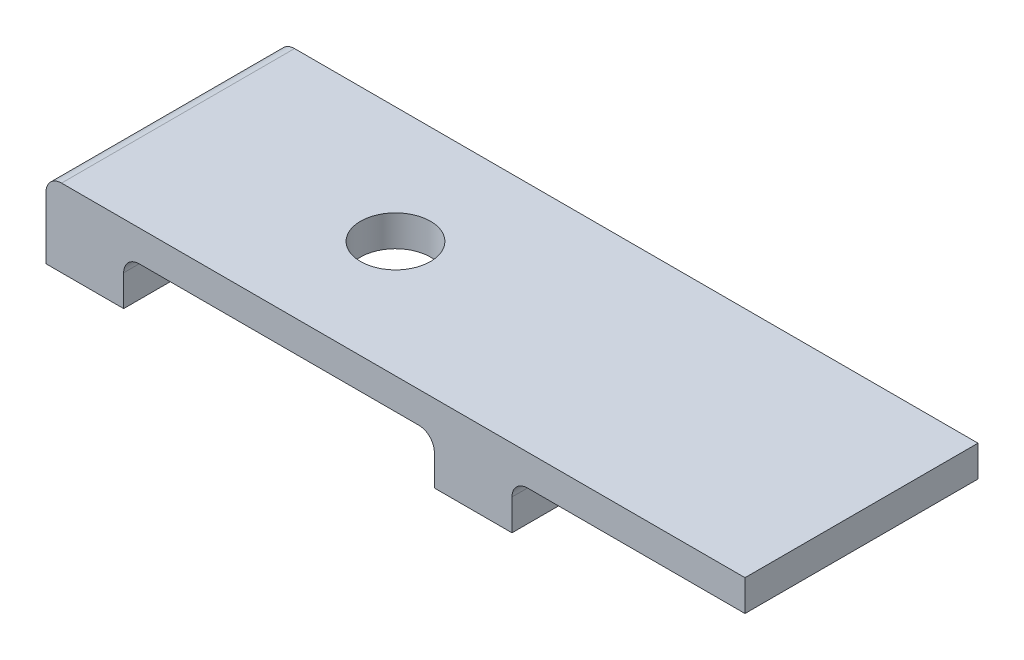
from build123d import *

# Parameters (mm, degrees)
BOSS_EXTRUDE1_DEPTH = 15
FILLET1_R           = 1
FILLET2_R           = 1
FILLET3_R           = 1
FILLET4_R           = 1
SKETCH2_R           = 2.25
CUT_EXTRUDE1_DEPTH  = 5


with BuildPart() as part:
    # Sketch1 → Boss-Extrude1 (new body)
    with BuildSketch(Plane.XY):
        Polygon((0, 0), (45, 0), (45, -2), (30, -2), (30, -5), (25, -5), (25, -2), (5, -2), (5, -5), (0, -5), align=None)
    extrude(amount=BOSS_EXTRUDE1_DEPTH)

    # Fillet1
    fillet1_edges = [part.edges().sort_by_distance(p)[0] for p in [
        (0, 0, 7.5),
    ]]
    fillet(fillet1_edges, radius=FILLET1_R)

    # Fillet2
    fillet2_edges = [part.edges().sort_by_distance(p)[0] for p in [
        (5, -2, 7.5),
    ]]
    fillet(fillet2_edges, radius=FILLET2_R)

    # Fillet3
    fillet3_edges = [part.edges().sort_by_distance(p)[0] for p in [
        (25, -2, 7.5),
    ]]
    fillet(fillet3_edges, radius=FILLET3_R)

    # Fillet4
    fillet4_edges = [part.edges().sort_by_distance(p)[0] for p in [
        (30, -2, 7.5),
    ]]
    fillet(fillet4_edges, radius=FILLET4_R)

    # Sketch2 → Cut-Extrude1 (cut)
    with BuildSketch(Plane(origin=(0, 0, 0), x_dir=(1, 0, 0), z_dir=(0, 1, 0))):
        with Locations(Location((15, -7.5, 0), (0, 0, 270))):
            Circle(SKETCH2_R)
    extrude(amount=-CUT_EXTRUDE1_DEPTH, mode=Mode.SUBTRACT)


solid = part.part
